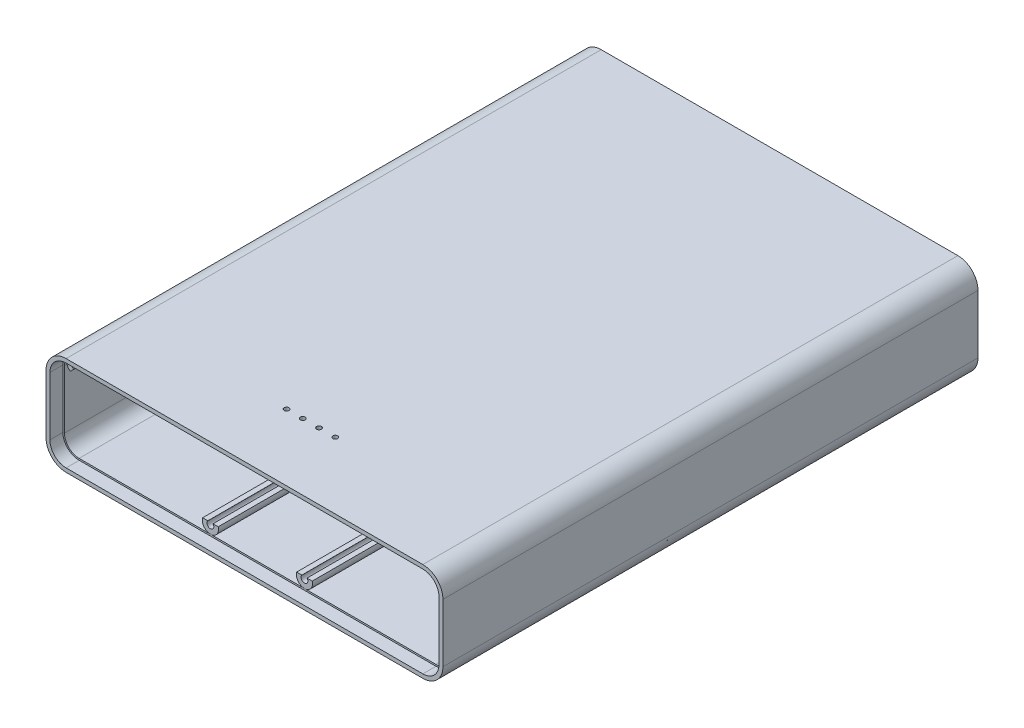
from build123d import *

# Parameters (mm, degrees)
BOSS_EXTRUDE2_DEPTH        = 83
BOSS_EXTRUDE2_DEPTH_BACK   = 82
BOSS_EXTRUDE3_DEPTH        = 79
BOSS_EXTRUDE3_DEPTH_BACK   = 79
BOSS_EXTRUDE5_DEPTH        = 79
BOSS_EXTRUDE5_DEPTH_BACK   = 79
BOSS_EXTRUDE5_2_DEPTH      = 79
BOSS_EXTRUDE5_2_DEPTH_BACK = 79
BOSS_EXTRUDE5_3_DEPTH      = 79
BOSS_EXTRUDE5_3_DEPTH_BACK = 79
BOSS_EXTRUDE5_4_DEPTH      = 79
BOSS_EXTRUDE5_4_DEPTH_BACK = 79
SKETCH9_R                  = 0.75
CUT_EXTRUDE3_DEPTH         = 79


with BuildPart() as part:
    # Sketch1 → Boss-Extrude2 (new, two sides: drawn at the far end of the back side and taken through both)
    with BuildSketch(Plane.XY.offset(-BOSS_EXTRUDE2_DEPTH_BACK)):
        with BuildLine():
            ThreePointArc((55, 15.2), (59.384062043, 13.384062043), (61.2, 9))
            Line((61.2, 9), (61.2, -9))
            ThreePointArc((61.2, -9), (59.384062043, -13.384062043), (55, -15.2))
            Line((55, -15.2), (0, -15.2))
            Line((0, -15.2), (-55, -15.2))
            ThreePointArc((-55, -15.2), (-59.384062043, -13.384062043), (-61.2, -9))
            Line((-61.2, -9), (-61.2, 9))
            ThreePointArc((-61.2, 9), (-59.384062043, 13.384062043), (-55, 15.2))
            Line((-55, 15.2), (0, 15.2))
            Line((0, 15.2), (55, 15.2))
        make_face()
        with BuildLine():
            ThreePointArc((-55, 14), (-58.535533906, 12.535533906), (-60, 9))
            Line((-60, 9), (-60, -9))
            ThreePointArc((-60, -9), (-58.535533906, -12.535533906), (-55, -14))
            Line((-55, -14), (0, -14))
            Line((0, -14), (55, -14))
            ThreePointArc((55, -14), (58.535533906, -12.535533906), (60, -9))
            Line((60, -9), (60, 9))
            ThreePointArc((60, 9), (58.535533906, 12.535533906), (55, 14))
            Line((55, 14), (0, 14))
            Line((0, 14), (-55, 14))
        make_face(mode=Mode.SUBTRACT)
    extrude(amount=BOSS_EXTRUDE2_DEPTH + BOSS_EXTRUDE2_DEPTH_BACK)

    # Sketch2 → Boss-Extrude3 (add, two sides: drawn at the far end of the back side and taken through both)
    with BuildSketch(Plane.XY.offset(-BOSS_EXTRUDE3_DEPTH_BACK)):
        with BuildLine():
            Line((0, 14.052488348), (-55, 14.052488348))
            ThreePointArc((-55, 14.052488348), (-58.535533906, 12.588022254), (-60, 9.052488348))
            Line((-60, 9.052488348), (-60, -8.947511652))
            ThreePointArc((-60, -8.947511652), (-58.535533906, -12.483045558), (-55, -13.947511652))
            Line((-55, -13.947511652), (0, -13.947511652))
            Line((0, -13.947511652), (55, -13.947511652))
            ThreePointArc((55, -13.947511652), (58.535533906, -12.483045558), (60, -8.947511652))
            Line((60, -8.947511652), (60, 9.052488348))
            ThreePointArc((60, 9.052488348), (58.535533906, 12.588022254), (55, 14.052488348))
            Line((55, 14.052488348), (0, 14.052488348))
        make_face()
        with BuildLine():
            Line((0, 13.552488348), (55, 13.552488348))
            ThreePointArc((55, 13.552488348), (58.181980515, 12.234468864), (59.5, 9.052488348))
            Line((59.5, 9.052488348), (59.5, -8.947511652))
            ThreePointArc((59.5, -8.947511652), (58.181980515, -12.129492167), (55, -13.447511652))
            Line((55, -13.447511652), (0, -13.447511652))
            Line((0, -13.447511652), (-55, -13.447511652))
            ThreePointArc((-55, -13.447511652), (-58.181980515, -12.129492167), (-59.5, -8.947511652))
            Line((-59.5, -8.947511652), (-59.5, 9.052488348))
            ThreePointArc((-59.5, 9.052488348), (-58.181980515, 12.234468864), (-55, 13.552488348))
            Line((-55, 13.552488348), (0, 13.552488348))
        make_face(mode=Mode.SUBTRACT)
    extrude(amount=BOSS_EXTRUDE3_DEPTH + BOSS_EXTRUDE3_DEPTH_BACK)

    # Sketch9 → Cut-Extrude3 (cut)
    with BuildSketch(Plane(origin=(0, 0, 0), x_dir=(1, 0, 0), z_dir=(0, 1, 0))):
        with Locations(Location((-7.5, -62.5, 0), (0, 0, 90))):
            Circle(SKETCH9_R)
        with Locations(Location((-2.5, -62.5, 0), (0, 0, 90))):
            Circle(SKETCH9_R)
        with Locations(Location((2.5, -62.5, 0), (0, 0, 90))):
            Circle(SKETCH9_R)
        with Locations(Location((7.5, -62.5, 0), (0, 0, 90))):
            Circle(SKETCH9_R)
    extrude(amount=CUT_EXTRUDE3_DEPTH, mode=Mode.SUBTRACT)


with BuildPart() as body_2:
    # Sketch3 → Boss-Extrude5 (new, two sides: drawn at the far end of the back side and taken through both)
    with BuildSketch(Plane.XY.offset(-BOSS_EXTRUDE5_DEPTH_BACK)):
        with BuildLine():
            ThreePointArc((-55.297347491, 10.749147187), (-57.051582041, 11.308821518), (-56.580263808, 9.528812154))
            Line((-56.580263808, 9.528812154), (-57.7034092, 8.460454342))
            ThreePointArc((-57.7034092, 8.460454342), (-58.050942002, 12.359430707), (-54.174202099, 11.817504998))
            Line((-54.174202099, 11.817504998), (-55.297347491, 10.749147187))
        make_face()
    extrude(amount=BOSS_EXTRUDE5_DEPTH + BOSS_EXTRUDE5_DEPTH_BACK)


with BuildPart() as body_3:
    # Sketch3 → Boss-Extrude5 2 (new, two sides: drawn at the far end of the back side and taken through both)
    with BuildSketch(Plane.XY.offset(-BOSS_EXTRUDE5_2_DEPTH_BACK)):
        with BuildLine():
            ThreePointArc((-15.299294362, -10.266608926), (-14.5, -11.997511652), (-13.700705638, -10.266608926))
            Line((-13.700705638, -10.266608926), (-12.094512216, -10.266608926))
            ThreePointArc((-12.094512216, -10.266608926), (-14.5, -13.447511652), (-16.905487784, -10.266608926))
            Line((-16.905487784, -10.266608926), (-15.299294362, -10.266608926))
        make_face()
    extrude(amount=BOSS_EXTRUDE5_2_DEPTH + BOSS_EXTRUDE5_2_DEPTH_BACK)


with BuildPart() as body_4:
    # Sketch3 → Boss-Extrude5 3 (new, two sides: drawn at the far end of the back side and taken through both)
    with BuildSketch(Plane.XY.offset(-BOSS_EXTRUDE5_3_DEPTH_BACK)):
        with BuildLine():
            ThreePointArc((16.905487784, -10.266608926), (14.5, -13.447511652), (12.094512216, -10.266608926))
            Line((12.094512216, -10.266608926), (13.700705638, -10.266608926))
            ThreePointArc((13.700705638, -10.266608926), (14.5, -11.997511652), (15.299294362, -10.266608926))
            Line((15.299294362, -10.266608926), (16.905487784, -10.266608926))
        make_face()
    extrude(amount=BOSS_EXTRUDE5_3_DEPTH + BOSS_EXTRUDE5_3_DEPTH_BACK)


with BuildPart() as body_5:
    # Sketch3 → Boss-Extrude5 4 (new, two sides: drawn at the far end of the back side and taken through both)
    with BuildSketch(Plane.XY.offset(-BOSS_EXTRUDE5_4_DEPTH_BACK)):
        with BuildLine():
            ThreePointArc((54.174202099, 11.817504998), (58.050942002, 12.359430707), (57.7034092, 8.460454342))
            Line((57.7034092, 8.460454342), (56.580263808, 9.528812154))
            ThreePointArc((56.580263808, 9.528812154), (57.051582041, 11.308821518), (55.297347491, 10.749147187))
            Line((55.297347491, 10.749147187), (54.174202099, 11.817504998))
        make_face()
    extrude(amount=BOSS_EXTRUDE5_4_DEPTH + BOSS_EXTRUDE5_4_DEPTH_BACK)


solid = Compound([part.part, body_2.part, body_3.part, body_4.part, body_5.part])
